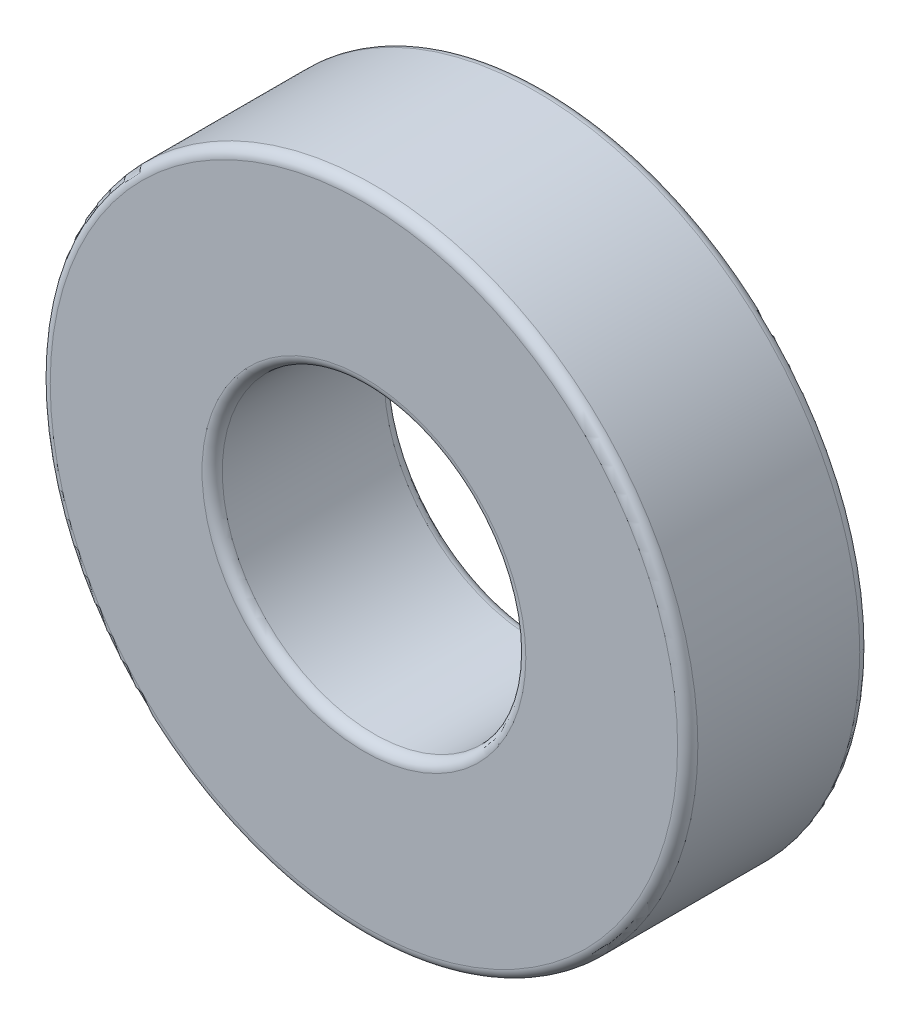
from build123d import *

# Parameters (mm, degrees)
ESQUISSE1_R        = 16
ESQUISSE1_R_2      = 7.5
BOSS_EXTRU_1_DEPTH = 9
CONG_1_R           = 0.5


with BuildPart() as part:
    # Esquisse1 → Boss.-Extru.1 (new body)
    with BuildSketch(Plane.XY):
        Circle(ESQUISSE1_R)
        Circle(ESQUISSE1_R_2, mode=Mode.SUBTRACT)
    extrude(amount=BOSS_EXTRU_1_DEPTH)

    # Congé1
    cong_1_edges = [part.edges().sort_by_distance(p)[0] for p in [
        (-16, 0, 0),
        (-16, 0, 9),
        (-7.5, 0, 0),
        (-7.5, 0, 9),
    ]]
    fillet(cong_1_edges, radius=CONG_1_R)


solid = part.part
